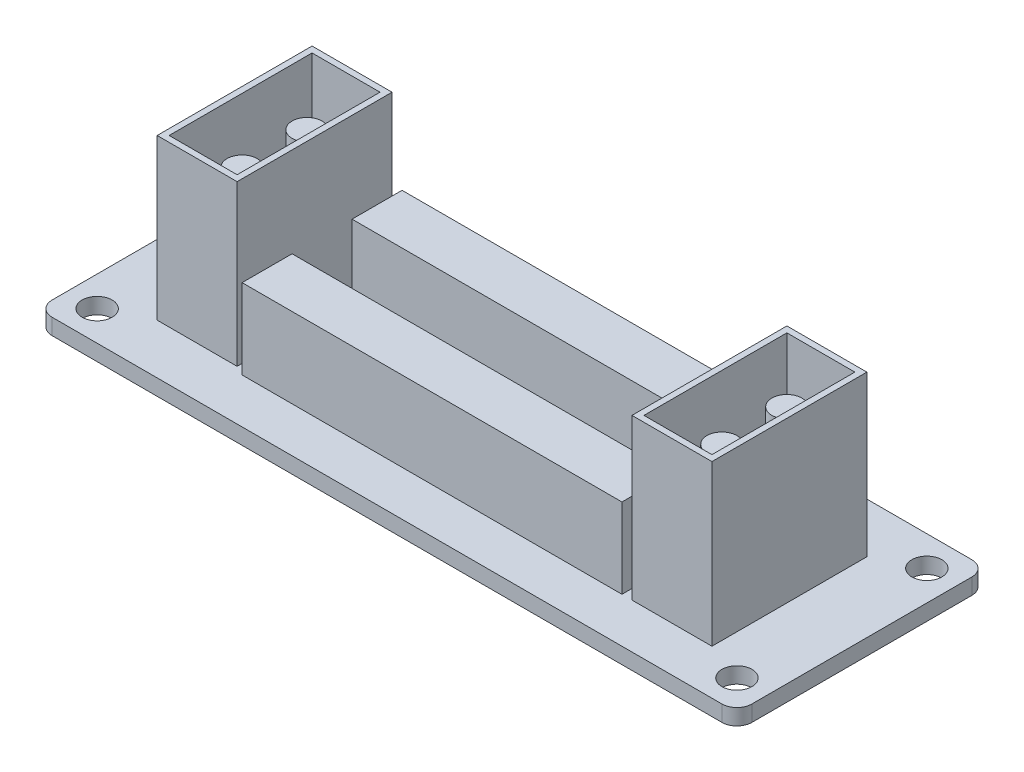
from build123d import *

# Parameters (mm, degrees)
EXTRUDE_1_DEPTH     = 1.6
SKETCH_3_R          = 1.5
CUT_EXTRUDE_1_DEPTH = 1.6
SKETCH_8_W          = 8
SKETCH_8_H          = 15.5
EXTRUDE_2_DEPTH     = 16
SHELL_1_T           = -0.6
SKETCH_11_R         = 1.5
EXTRUDE_3_DEPTH     = 14
SKETCH_12_W         = 38
SKETCH_12_H         = 5
EXTRUDE_4_DEPTH     = 8
SKETCH_17_W         = 38.038888129
SKETCH_17_H         = 5
SKETCH_17_W_2       = 38
EXTRUDE_5_DEPTH     = 1


with BuildPart() as part:
    # 草图2 → 凸台-拉伸1 (new body)
    with BuildSketch(Plane(origin=(0, 0, 0), x_dir=(1, 0, 0), z_dir=(0, 1, 0))):
        with BuildLine():
            Line((-82.363056433, 39.03274813), (-15.363056433, 39.03274813))
            ThreePointArc((-15.363056433, 39.03274813), (-14.302396261, 38.593408302), (-13.863056433, 37.53274813))
            Line((-13.863056433, 37.53274813), (-13.863056433, 15.53274813))
            ThreePointArc((-13.863056433, 15.53274813), (-14.302396261, 14.472087958), (-15.363056433, 14.03274813))
            Line((-15.363056433, 14.03274813), (-82.363056433, 14.03274813))
            ThreePointArc((-82.363056433, 14.03274813), (-83.423716605, 14.472087958), (-83.863056433, 15.53274813))
            Line((-83.863056433, 15.53274813), (-83.863056433, 37.53274813))
            ThreePointArc((-83.863056433, 37.53274813), (-83.423716605, 38.593408302), (-82.363056433, 39.03274813))
        make_face()
    extrude(amount=EXTRUDE_1_DEPTH)

    # 草图3 → 切除-拉伸1 (cut)
    with BuildSketch(Plane(origin=(0, 1.6, 0), x_dir=(1, 0, 0), z_dir=(0, 1, 0))):
        with Locations(Location((-80.863056433, 36.03274813, 0), (0, 0, 270))):
            Circle(SKETCH_3_R)
        with Locations(Location((-16.863056433, 36.03274813, 0), (0, 0, 270))):
            Circle(SKETCH_3_R)
        with Locations(Location((-16.863056433, 17.03274813, 0), (0, 0, 90))):
            Circle(SKETCH_3_R)
        with Locations(Location((-80.863056433, 17.03274813, 0), (0, 0, 90))):
            Circle(SKETCH_3_R)
    extrude(amount=-CUT_EXTRUDE_1_DEPTH, mode=Mode.SUBTRACT)

    # 草图8 → 凸台-拉伸2 (add)
    with BuildSketch(Plane(origin=(0, 1.6, 0), x_dir=(1, 0, 0), z_dir=(0, 1, 0))):
        with Locations((-72.863056433, 26.78274813)):
            Rectangle(SKETCH_8_W, SKETCH_8_H)
        with Locations((-24.863056433, 26.28274813)):
            Rectangle(SKETCH_8_W, SKETCH_8_H)
    extrude(amount=EXTRUDE_2_DEPTH)

    # 抽壳1
    shell_1_openings = [part.faces().sort_by_distance(p)[0] for p in [
        (-72.863056433, 17.6, -26.78274813),
        (-24.863056433, 17.6, -26.28274813),
    ]]
    offset(amount=SHELL_1_T, openings=shell_1_openings, kind=Kind.INTERSECTION)

    # 草图11 → 凸台-拉伸3 (add)
    with BuildSketch(Plane(origin=(0, 0.6, 0), x_dir=(1, 0, 0), z_dir=(0, 1, 0))):
        with Locations(Location((-72.863056433, 30.03274813, 0), (0, 0, 270))):
            Circle(SKETCH_11_R)
        with Locations(Location((-72.863056433, 23.53274813, 0), (0, 0, 270))):
            Circle(SKETCH_11_R)
        with Locations(Location((-24.863056433, 30.03274813, 0), (0, 0, 270))):
            Circle(SKETCH_11_R)
        with Locations(Location((-24.863056433, 23.53274813, 0), (0, 0, 270))):
            Circle(SKETCH_11_R)
    extrude(amount=EXTRUDE_3_DEPTH)

    # 草图12 → 凸台-拉伸4 (add)
    with BuildSketch(Plane(origin=(0, 1.6, 0), x_dir=(1, 0, 0), z_dir=(0, 1, 0))):
        with Locations((-48.863056433, 32.03274813)):
            Rectangle(SKETCH_12_W, SKETCH_12_H)
        with Locations((-48.863056433, 21.03274813)):
            Rectangle(SKETCH_12_W, SKETCH_12_H)
    extrude(amount=EXTRUDE_4_DEPTH)

    # 草图17 → 凸台-拉伸5 (add)
    with BuildSketch(Plane.XZ):
        with Locations((-48.843612369, -21.03274813)):
            Rectangle(SKETCH_17_W, SKETCH_17_H)
        with Locations((-48.863056433, -32.03274813)):
            Rectangle(SKETCH_17_W_2, SKETCH_17_H)
    extrude(amount=EXTRUDE_5_DEPTH)


solid = part.part
